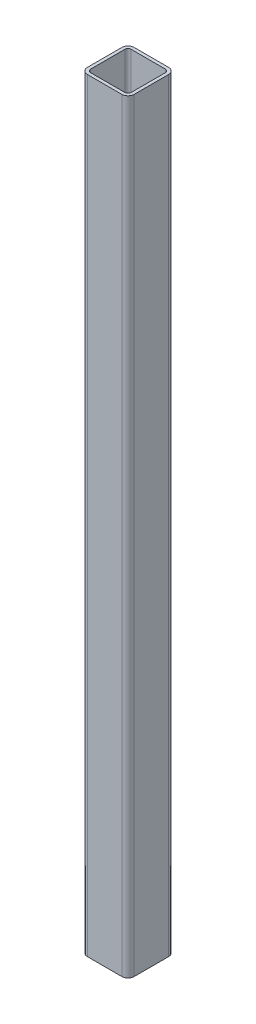
from build123d import *

# Parameters (mm, degrees)
EXTRUDE_1_DEPTH     = 245
SKETCH_2_W          = 23
SKETCH_2_H          = 40
CUT_EXTRUDE_1_DEPTH = 18


with BuildPart() as part:
    # 草图1 → 凸台-拉伸1 (new, symmetric)
    with BuildSketch(Plane(origin=(0, 0, 0), x_dir=(1, 0, 0), z_dir=(0, 1, 0))):
        with BuildLine():
            Line((4, 0), (26, 0))
            ThreePointArc((26, 0), (28.828427125, 1.171572875), (30, 4))
            Line((30, 4), (30, 26))
            ThreePointArc((30, 26), (28.828427125, 28.828427125), (26, 30))
            Line((26, 30), (4, 30))
            ThreePointArc((4, 30), (1.171572875, 28.828427125), (0, 26))
            Line((0, 26), (0, 4))
            ThreePointArc((0, 4), (1.171572875, 1.171572875), (4, 0))
        make_face()
        with BuildLine():
            Line((4, 2), (26, 2))
            ThreePointArc((26, 2), (27.414213562, 2.585786438), (28, 4))
            Line((28, 4), (28, 26))
            ThreePointArc((28, 26), (27.414213562, 27.414213562), (26, 28))
            Line((26, 28), (4, 28))
            ThreePointArc((4, 28), (2.585786438, 27.414213562), (2, 26))
            Line((2, 26), (2, 4))
            ThreePointArc((2, 4), (2.585786438, 2.585786438), (4, 2))
        make_face(mode=Mode.SUBTRACT)
    extrude(amount=EXTRUDE_1_DEPTH, both=True)

    # 草图2 → 切除-拉伸1 (cut)
    with BuildSketch(Plane.XY.offset(-30)):
        with Locations((11.5, 0)):
            Rectangle(SKETCH_2_W, SKETCH_2_H)
    extrude(amount=CUT_EXTRUDE_1_DEPTH, mode=Mode.SUBTRACT)


solid = part.part
